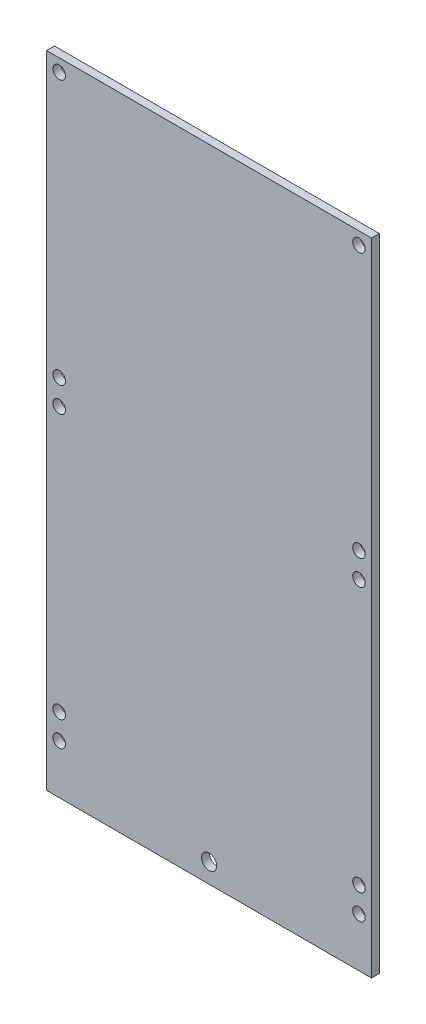
from build123d import *

# Parameters (mm, degrees)
SKETCH1_W           = 83
SKETCH1_H           = 327.5
BOSS_EXTRUDE1_DEPTH = 2
SKETCH2_R           = 1.6
CUT_EXTRUDE1_DEPTH  = 2
SKETCH3_R           = 1.93
CUT_EXTRUDE2_DEPTH  = 2
SKETCH4_W           = 116.407651787
SKETCH4_H           = 181.18090695
CUT_EXTRUDE3_DEPTH  = 10


with BuildPart() as part:
    # Sketch1 → Boss-Extrude1 (new body)
    with BuildSketch(Plane.XY):
        with Locations((41.5, 163.75)):
            Rectangle(SKETCH1_W, SKETCH1_H)
    extrude(amount=BOSS_EXTRUDE1_DEPTH)

    # Sketch2 → Cut-Extrude1 (cut)
    with BuildSketch(Plane.XY.offset(2)):
        with Locations((3.2, 314.9)):
            Circle(SKETCH2_R)
        with Locations((3.2, 308.5)):
            Circle(SKETCH2_R)
        with Locations((79.8, 314.9)):
            Circle(SKETCH2_R)
        with Locations((79.8, 308.5)):
            Circle(SKETCH2_R)
        with Locations((3.2, 240.925)):
            Circle(SKETCH2_R)
        with Locations((3.2, 234.525)):
            Circle(SKETCH2_R)
        with Locations((79.8, 240.925)):
            Circle(SKETCH2_R)
        with Locations((79.8, 234.525)):
            Circle(SKETCH2_R)
        with Locations((3.2, 166.95)):
            Circle(SKETCH2_R)
        with Locations((3.2, 160.55)):
            Circle(SKETCH2_R)
        with Locations((79.8, 166.95)):
            Circle(SKETCH2_R)
        with Locations((79.8, 160.55)):
            Circle(SKETCH2_R)
        with Locations((3.2, 92.975)):
            Circle(SKETCH2_R)
        with Locations((3.2, 86.575)):
            Circle(SKETCH2_R)
        with Locations((79.8, 92.975)):
            Circle(SKETCH2_R)
        with Locations((79.8, 86.575)):
            Circle(SKETCH2_R)
        with Locations((3.2, 19)):
            Circle(SKETCH2_R)
        with Locations((3.2, 12.6)):
            Circle(SKETCH2_R)
        with Locations((79.8, 19)):
            Circle(SKETCH2_R)
        with Locations((79.8, 12.6)):
            Circle(SKETCH2_R)
    extrude(amount=-CUT_EXTRUDE1_DEPTH, mode=Mode.SUBTRACT)

    # Sketch3 → Cut-Extrude2 (cut)
    with BuildSketch(Plane.XY.offset(2)):
        with Locations((41.5, 322.524)):
            Circle(SKETCH3_R)
        with Locations((41.5, 4.976)):
            Circle(SKETCH3_R)
    extrude(amount=-CUT_EXTRUDE2_DEPTH, mode=Mode.SUBTRACT)

    # Sketch4 → Cut-Extrude3 (cut)
    with BuildSketch(Plane.XY.offset(2)):
        with Locations((24.796174107, 254.340453475)):
            Rectangle(SKETCH4_W, SKETCH4_H)
    extrude(amount=-CUT_EXTRUDE3_DEPTH, mode=Mode.SUBTRACT)


solid = part.part
